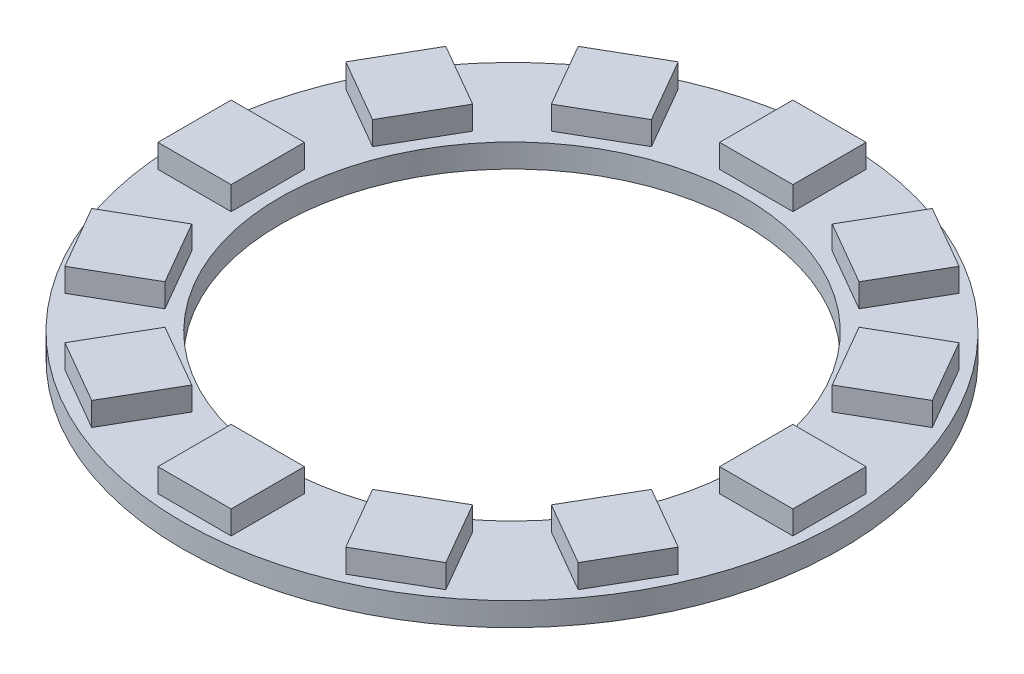
from build123d import *

# Parameters (mm, degrees)
PCB_START   = 32
SKETCH1_R   = 22.5
SKETCH1_R_2 = 15.85
PCB_DEPTH   = 1.6
LEDS_START  = 33.6
SKETCH2_W   = 5
SKETCH2_H   = 5
LEDS_DEPTH  = 1.6


with BuildPart() as part:
    # Sketch1 → PCB (new body)
    with BuildSketch(Plane(origin=(0, 0, 0), x_dir=(1, 0, 0), z_dir=(0, 1, 0)).offset(PCB_START)):
        with Locations(Location((0, 0, 0), (0, 0, 270))):
            Circle(SKETCH1_R)
        with Locations(Location((0, 0, 0), (0, 0, 270))):
            Circle(SKETCH1_R_2, mode=Mode.SUBTRACT)
    extrude(amount=PCB_DEPTH)

    # Sketch2 → LEDs (add)
    with BuildSketch(Plane(origin=(0, 0, 0), x_dir=(1, 0, 0), z_dir=(0, 1, 0)).offset(LEDS_START)):
        with Locations((19.175, 0)):
            Rectangle(SKETCH2_W, SKETCH2_H)
        Polygon((15.690973608, -6.172436491), (20.021100627, -8.672436491), (17.521100627, -13.002563509), (13.190973608, -10.502563509), align=None)
        Polygon((10.502563509, -13.190973608), (13.002563509, -17.521100627), (8.672436491, -20.021100627), (6.172436491, -15.690973608), align=None)
        with Locations((0, -19.175)):
            Rectangle(SKETCH2_W, SKETCH2_H)
        Polygon((-6.172436491, -15.690973608), (-8.672436491, -20.021100627), (-13.002563509, -17.521100627), (-10.502563509, -13.190973608), align=None)
        Polygon((-13.190973608, -10.502563509), (-17.521100627, -13.002563509), (-20.021100627, -8.672436491), (-15.690973608, -6.172436491), align=None)
        with Locations((-19.175, 0)):
            Rectangle(SKETCH2_W, SKETCH2_H)
        Polygon((-15.690973608, 6.172436491), (-20.021100627, 8.672436491), (-17.521100627, 13.002563509), (-13.190973608, 10.502563509), align=None)
        Polygon((-10.502563509, 13.190973608), (-13.002563509, 17.521100627), (-8.672436491, 20.021100627), (-6.172436491, 15.690973608), align=None)
        with Locations((0, 19.175)):
            Rectangle(SKETCH2_W, SKETCH2_H)
        Polygon((6.172436491, 15.690973608), (8.672436491, 20.021100627), (13.002563509, 17.521100627), (10.502563509, 13.190973608), align=None)
        Polygon((13.190973608, 10.502563509), (17.521100627, 13.002563509), (20.021100627, 8.672436491), (15.690973608, 6.172436491), align=None)
    extrude(amount=LEDS_DEPTH)


solid = part.part
